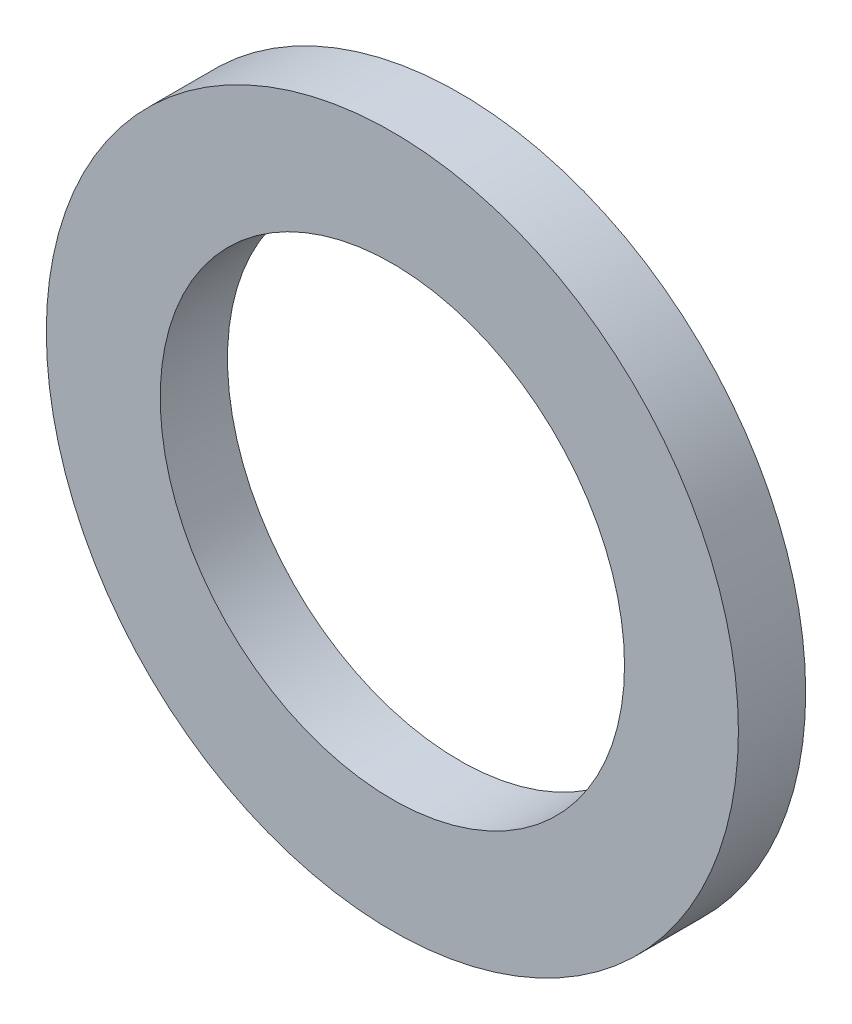
from build123d import *

# Parameters (mm, degrees)
IZIM1_R                     = 10.285
IZIM1_R_2                   = 6.9
Y_KSEKLIK_EKSTR_ZYON1_DEPTH = 2


with BuildPart() as part:
    # Çizim1 → Yükseklik-Ekstrüzyon1 (new body)
    with BuildSketch(Plane.XY):
        Circle(IZIM1_R)
        Circle(IZIM1_R_2, mode=Mode.SUBTRACT)
    extrude(amount=Y_KSEKLIK_EKSTR_ZYON1_DEPTH)


solid = part.part
